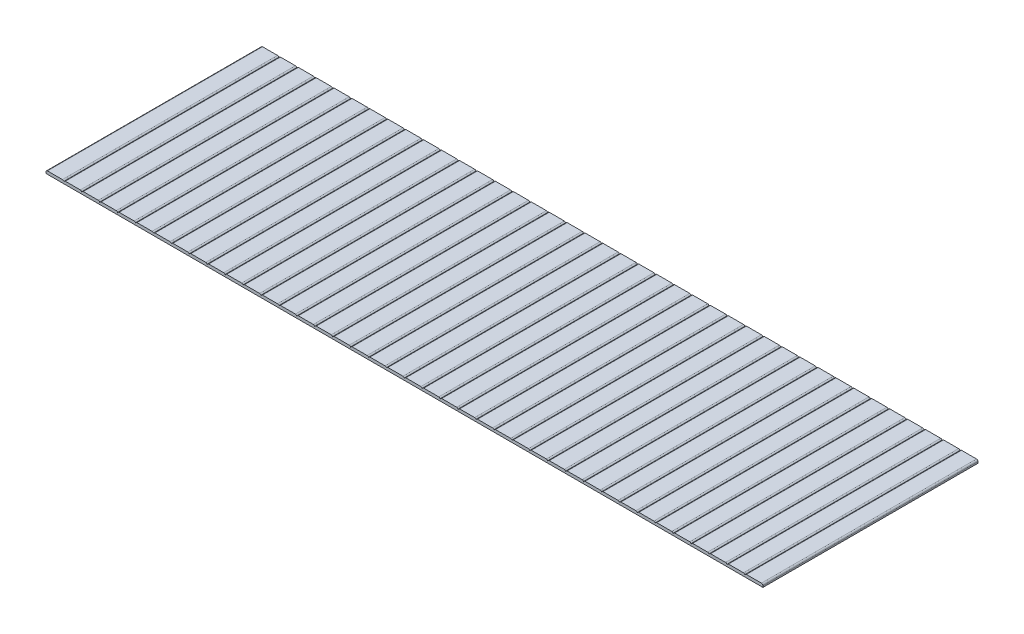
from build123d import *

# Parameters (mm, degrees)
BOSS_EXTRUDE1_DEPTH = 3657.6
LPATTERN1_COUNT     = 40
LPATTERN1_PITCH     = 304.8


with BuildPart() as part:
    # Sketch1 → Boss-Extrude1 (new body)
    with BuildSketch(Plane.XY):
        with BuildLine():
            Line((6096, 2895.6), (5791.2, 2895.6))
            Line((5791.2, 2895.6), (5791.2, 2921))
            ThreePointArc((5791.2, 2921), (5798.639487758, 2938.960512242), (5816.6, 2946.4))
            Line((5816.6, 2946.4), (6070.6, 2946.4))
            ThreePointArc((6070.6, 2946.4), (6088.560512242, 2938.960512242), (6096, 2921))
            Line((6096, 2921), (6096, 2895.6))
        make_face()
    boss_extrude1 = extrude(amount=-BOSS_EXTRUDE1_DEPTH)

    # LPattern1: Boss-Extrude1 ×40
    with Locations(*[(-i * LPATTERN1_PITCH, 0, 0) for i in range(1, LPATTERN1_COUNT)]):
        add(boss_extrude1)


solid = part.part
